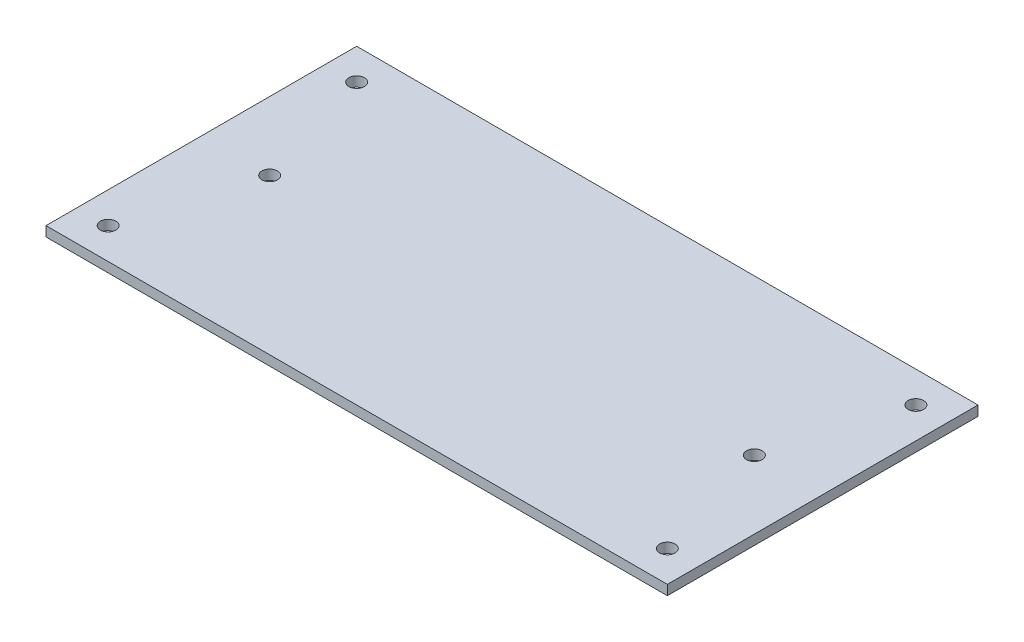
from build123d import *

# Parameters (mm, degrees)
SKETCH1_W           = 200
SKETCH1_H           = 100
SKETCH1_R           = 2.5
SKETCH1_W_2         = 120.5
SKETCH1_H_2         = 64
BOSS_EXTRUDE1_DEPTH = 3.175
SKETCH2_R           = 2.5
CUT_EXTRUDE1_DEPTH  = 112.848471715


with BuildPart() as part:
    # Sketch1 → Boss-Extrude1 (new body)
    # profile 1 of 2: a face of its own
    with BuildSketch(Plane(origin=(0, 0, 0), x_dir=(1, 0, 0), z_dir=(0, 1, 0))):
        Rectangle(SKETCH1_W, SKETCH1_H)
        with Locations(Location((90, -40, 0), (0, 0, 270))):
            Circle(SKETCH1_R, mode=Mode.SUBTRACT)
        with Locations(Location((-90, -40, 0), (0, 0, 270))):
            Circle(SKETCH1_R, mode=Mode.SUBTRACT)
        with Locations(Location((-90, 40, 0), (0, 0, 270))):
            Circle(SKETCH1_R, mode=Mode.SUBTRACT)
        with Locations(Location((90, 40, 0), (0, 0, 270))):
            Circle(SKETCH1_R, mode=Mode.SUBTRACT)
        Rectangle(SKETCH1_W_2, SKETCH1_H_2, mode=Mode.SUBTRACT)
    # profile 2 of 2: a face of its own
    with BuildSketch(Plane(origin=(0, 0, 0), x_dir=(1, 0, 0), z_dir=(0, 1, 0))):
        Rectangle(SKETCH1_W_2, SKETCH1_H_2)
    extrude(amount=BOSS_EXTRUDE1_DEPTH)

    # Sketch2 → Cut-Extrude1 (cut, through all)
    with BuildSketch(Plane(origin=(0, 3.175, 0), x_dir=(1, 0, 0), z_dir=(0, 1, 0))):
        with Locations(Location((-78, 0, 0), (0, 0, 270))):
            Circle(SKETCH2_R)
        with Locations(Location((78, 0, 0), (0, 0, 90))):
            Circle(SKETCH2_R)
    extrude(amount=-CUT_EXTRUDE1_DEPTH, mode=Mode.SUBTRACT)


solid = part.part
